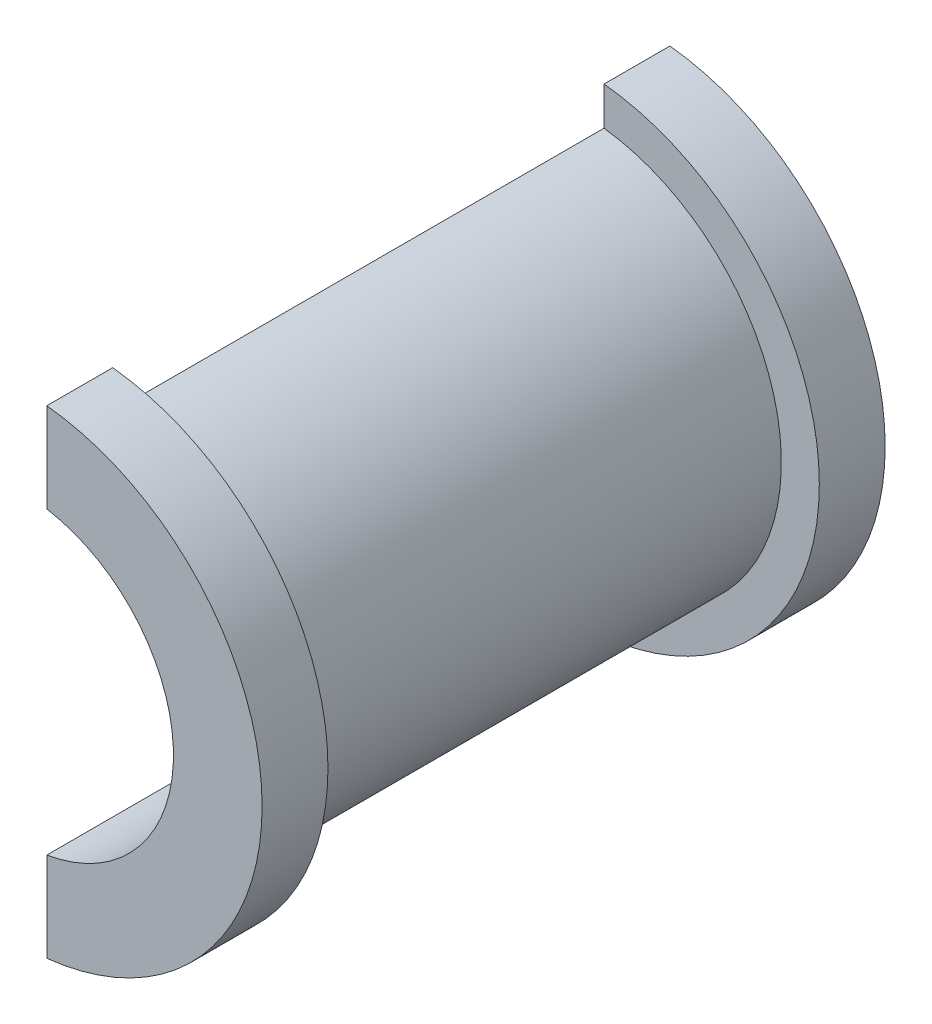
from build123d import *

# Parameters (mm, degrees)
BOSS_EXTRUDE1_DEPTH = 55
BOSS_EXTRUDE2_DEPTH = 6.5


with BuildPart() as part:
    # Sketch1 → Boss-Extrude1 (new, symmetric)
    with BuildSketch(Plane.XY):
        with BuildLine():
            Line((5, 29.580398915), (5, 39.686269666))
            ThreePointArc((5, 39.686269666), (40, 0), (5, -39.686269666))
            Line((5, -39.686269666), (5, -29.580398915))
            ThreePointArc((5, -29.580398915), (30, 0), (5, 29.580398915))
        make_face()
    extrude(amount=BOSS_EXTRUDE1_DEPTH, both=True)

    # Sketch2 → Boss-Extrude2 (add, symmetric)
    with BuildSketch(Plane.XY.offset(55)):
        with BuildLine():
            Line((5, 29.580398915), (5, 47.236109069))
            ThreePointArc((5, 47.236109069), (47.5, 0), (5, -47.236109069))
            Line((5, -47.236109069), (5, -29.580398915))
            ThreePointArc((5, -29.580398915), (30, 0), (5, 29.580398915))
        make_face()
    boss_extrude2 = extrude(amount=BOSS_EXTRUDE2_DEPTH, both=True)

    # Mirror2: Boss-Extrude2 across plane
    add(boss_extrude2.mirror(Plane.XY))


solid = part.part
